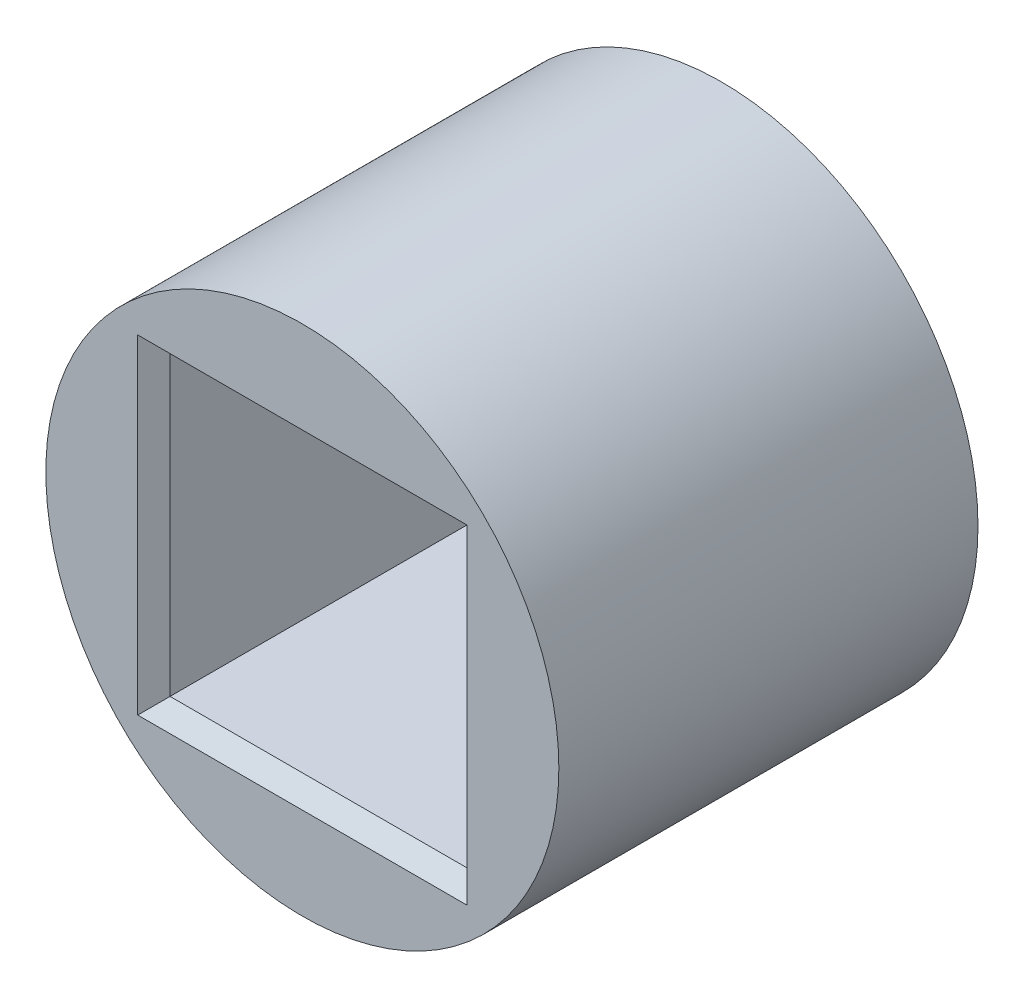
from build123d import *

# Parameters (mm, degrees)
SKETCH1_R           = 3.175
SKETCH1_W           = 3.675
SKETCH1_H           = 3.675
BOSS_EXTRUDE1_DEPTH = 5.188
CHAMFER1_SIZE       = 0.2


with BuildPart() as part:
    # Sketch1 → Boss-Extrude1 (new body)
    with BuildSketch(Plane.XY):
        Circle(SKETCH1_R)
        Rectangle(SKETCH1_W, SKETCH1_H, mode=Mode.SUBTRACT)
    extrude(amount=BOSS_EXTRUDE1_DEPTH)

    # Chamfer1
    chamfer1_edges = [part.edges().sort_by_distance(p)[0] for p in [
        (0, -1.8375, 5.188),
        (1.8375, 0, 0),
        (0, 1.8375, 0),
        (-1.8375, 0, 0),
        (0, -1.8375, 0),
        (1.8375, 0, 5.188),
        (0, 1.8375, 5.188),
        (-1.8375, 0, 5.188),
    ]]
    chamfer(chamfer1_edges, length=CHAMFER1_SIZE)


solid = part.part
